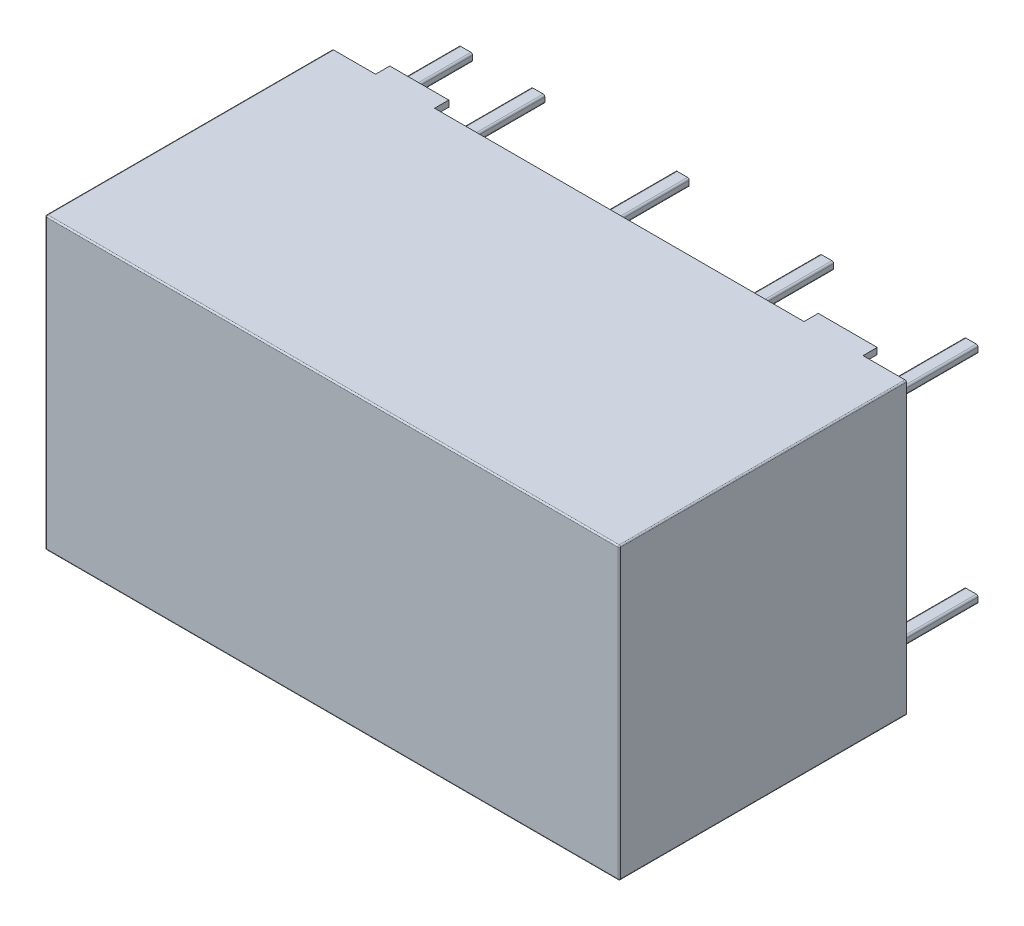
from build123d import *

# Parameters (mm, degrees)
SKETCH1_W            = 20.2
SKETCH1_H            = 10.2
BOSS_EXTRUDE1_DEPTH  = 10.6
SKETCH2_W            = 13
SKETCH2_H            = 10.2
SKETCH2_W_2          = 1.525
CUT_EXTRUDE1_DEPTH   = 0.5
SKETCH3_W            = 17.15
SKETCH3_H            = 9.76
CUT_EXTRUDE2_DEPTH   = 0.5
SKETCH4_W            = 0.48
SKETCH4_H            = 0.27
BOSS_EXTRUDE2_DEPTH  = 3.5
FILLET1_R            = 0.06
FILLET1_OF_MIRROR1_R = 0.06
FILLET2_R            = 0.05


with BuildPart() as part:
    # Sketch1 → Boss-Extrude1 (new body)
    with BuildSketch(Plane.XY):
        Rectangle(SKETCH1_W, SKETCH1_H)
    extrude(amount=BOSS_EXTRUDE1_DEPTH)

    # Sketch2 → Cut-Extrude1 (cut)
    with BuildSketch(Plane(origin=(0, 0, 0), x_dir=(-1, 0, 0), z_dir=(0, 0, -1))):
        Rectangle(SKETCH2_W, SKETCH2_H)
        with Locations((-9.3375, 0)):
            Rectangle(SKETCH2_W_2, SKETCH2_H)
        with Locations((9.3375, 0)):
            Rectangle(SKETCH2_W_2, SKETCH2_H)
    extrude(amount=-CUT_EXTRUDE1_DEPTH, mode=Mode.SUBTRACT)

    # Sketch3 → Cut-Extrude2 (cut)
    with BuildSketch(Plane(origin=(0, 0, 0), x_dir=(-1, 0, 0), z_dir=(0, 0, -1))):
        Rectangle(SKETCH3_W, SKETCH3_H)
    extrude(amount=-CUT_EXTRUDE2_DEPTH, mode=Mode.SUBTRACT)

    # Sketch4 → Boss-Extrude2 (add)
    with BuildSketch(Plane(origin=(0, 0, 0.5), x_dir=(-1, 0, 0), z_dir=(0, 0, -1))):
        with Locations((8.9, -3.81)):
            Rectangle(SKETCH4_W, SKETCH4_H)
        with Locations((6.36, -3.81)):
            Rectangle(SKETCH4_W, SKETCH4_H)
        with Locations((1.28, -3.81)):
            Rectangle(SKETCH4_W, SKETCH4_H)
        with Locations((-3.8, -3.81)):
            Rectangle(SKETCH4_W, SKETCH4_H)
        with Locations((-8.88, -3.81)):
            Rectangle(SKETCH4_W, SKETCH4_H)
    boss_extrude2 = extrude(amount=BOSS_EXTRUDE2_DEPTH)

    # Fillet1
    fillet1_edges = [part.edges().sort_by_distance(p)[0] for p in [
        (-6.6, -3.675, -1.25),
        (-6.6, -3.945, -1.25),
        (-6.12, -3.945, -1.25),
        (-6.12, -3.675, -1.25),
        (-1.52, -3.675, -1.25),
        (-1.52, -3.945, -1.25),
        (-1.04, -3.945, -1.25),
        (-1.04, -3.675, -1.25),
        (3.56, -3.675, -1.25),
        (3.56, -3.945, -1.25),
        (4.04, -3.945, -1.25),
        (4.04, -3.675, -1.25),
        (8.64, -3.675, -1.25),
        (8.64, -3.945, -1.25),
        (9.12, -3.945, -1.25),
        (9.12, -3.675, -1.25),
        (-8.66, -3.945, -1.25),
        (-8.66, -3.675, -1.25),
        (-9.14, -3.675, -1.25),
        (-9.14, -3.945, -1.25),
    ]]
    fillet(fillet1_edges, radius=FILLET1_R)

    # Mirror1: Boss-Extrude2 across plane
    add(boss_extrude2.mirror(Plane.ZX))

    # Fillet1 of Mirror1
    fillet1_of_mirror1_edges = [part.edges().sort_by_distance(p)[0] for p in [
        (-6.6, 3.675, -1.25),
        (-6.6, 3.945, -1.25),
        (-6.12, 3.945, -1.25),
        (-6.12, 3.675, -1.25),
        (-1.52, 3.675, -1.25),
        (-1.52, 3.945, -1.25),
        (-1.04, 3.945, -1.25),
        (-1.04, 3.675, -1.25),
        (3.56, 3.675, -1.25),
        (3.56, 3.945, -1.25),
        (4.04, 3.945, -1.25),
        (4.04, 3.675, -1.25),
        (8.64, 3.675, -1.25),
        (8.64, 3.945, -1.25),
        (9.12, 3.945, -1.25),
        (9.12, 3.675, -1.25),
        (-8.66, 3.945, -1.25),
        (-8.66, 3.675, -1.25),
        (-9.14, 3.675, -1.25),
        (-9.14, 3.945, -1.25),
    ]]
    fillet(fillet1_of_mirror1_edges, radius=FILLET1_OF_MIRROR1_R)

    # Fillet2
    fillet2_edges = [part.edges().sort_by_distance(p)[0] for p in [
        (-10.1, 0, 10.6),
        (0, -5.1, 10.6),
        (10.1, 0, 10.6),
        (0, 5.1, 10.6),
        (10.1, -5.1, 5.55),
        (-10.1, -5.1, 5.55),
        (-10.1, 5.1, 5.55),
        (10.1, 5.1, 5.55),
    ]]
    fillet(fillet2_edges, radius=FILLET2_R)


solid = part.part
